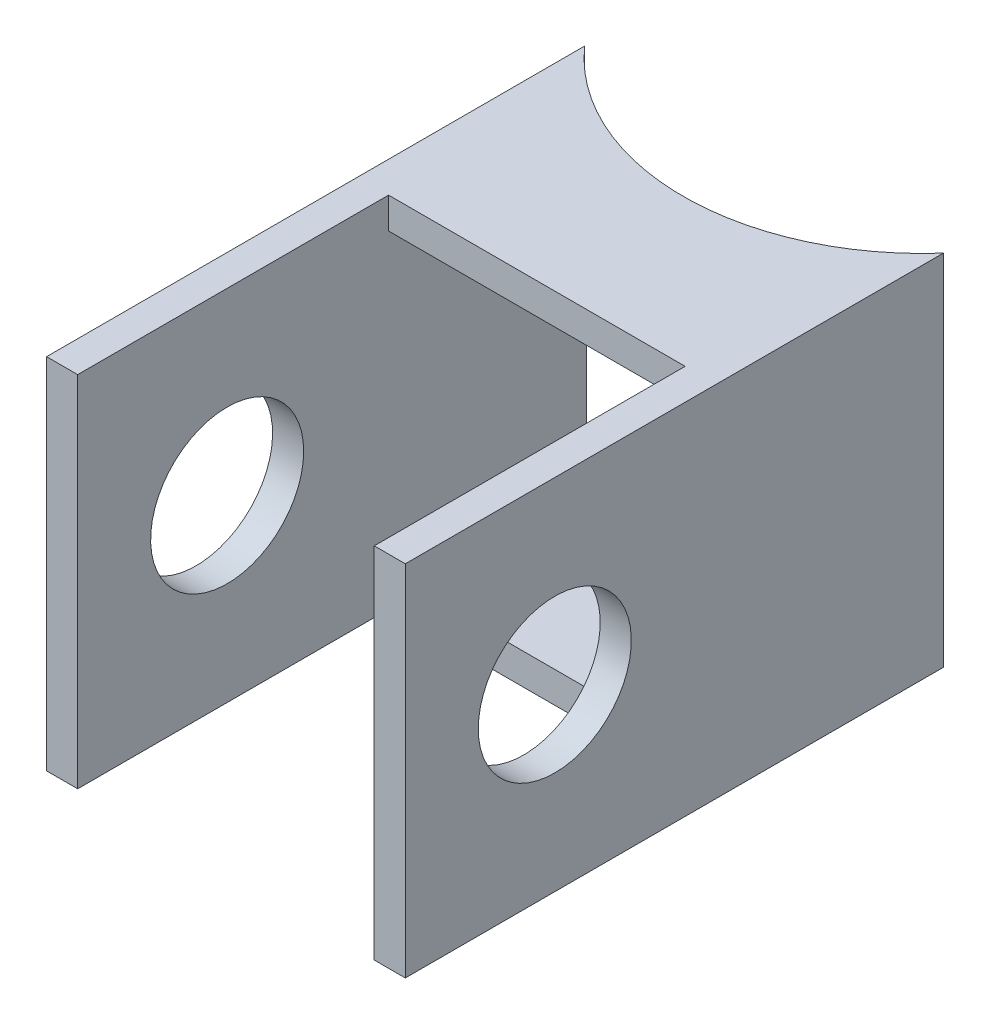
from build123d import *

# Parameters (mm, degrees)
SKETCH1_W               = 19.05
SKETCH1_H               = 19.05
SKETCH1_W_2             = 15.748
SKETCH1_H_2             = 15.748
BOSS_EXTRUDE1_DEPTH     = 28.575
CUT_EXTRUDE5_DEPTH      = 36.639286609
CUT_EXTRUDE5_DEPTH_BACK = 36.639286609
SKETCH5_R               = 12.7
CUT_EXTRUDE2_DEPTH      = 36.639286609
CUT_EXTRUDE2_DEPTH_BACK = 36.639286609
SKETCH3_R               = 4.064
CUT_EXTRUDE4_DEPTH      = 36.639286609
CUT_EXTRUDE4_DEPTH_BACK = 36.639286609
SKETCH4_W               = 15.748
SKETCH4_H               = 16.51


with BuildPart() as part:
    # Sketch1 → Boss-Extrude1 (new body)
    with BuildSketch(Plane.XY):
        Rectangle(SKETCH1_W, SKETCH1_H)
        Rectangle(SKETCH1_W_2, SKETCH1_H_2, mode=Mode.SUBTRACT)
    extrude(amount=BOSS_EXTRUDE1_DEPTH)

    # Sketch5 → Cut-Extrude5 (cut, two sides: drawn at the far end of the back side and taken through both)
    with BuildSketch(Plane(origin=(0, 9.525, 0), x_dir=(1, 0, 0), z_dir=(0, 1, 0)).offset(-CUT_EXTRUDE5_DEPTH_BACK)):
        with Locations((0, 8.400260413)):
            Circle(SKETCH5_R)
    extrude(amount=CUT_EXTRUDE5_DEPTH + CUT_EXTRUDE5_DEPTH_BACK, mode=Mode.SUBTRACT)

    # Sketch3 → Cut-Extrude2 (cut, two sides: drawn at the far end of the back side and taken through both)
    with BuildSketch(Plane(origin=(9.525, 0, 0), x_dir=(0, 0, -1), z_dir=(1, 0, 0)).offset(-CUT_EXTRUDE2_DEPTH_BACK)):
        with Locations((-20.6375, 0)):
            Circle(SKETCH3_R)
    extrude(amount=CUT_EXTRUDE2_DEPTH + CUT_EXTRUDE2_DEPTH_BACK, mode=Mode.SUBTRACT)

    # Sketch4 → Cut-Extrude4 (cut, two sides: drawn at the far end of the back side and taken through both)
    with BuildSketch(Plane.XZ.offset(9.525).offset(-CUT_EXTRUDE4_DEPTH_BACK)):
        with Locations((0, 20.32)):
            Rectangle(SKETCH4_W, SKETCH4_H)
    extrude(amount=CUT_EXTRUDE4_DEPTH + CUT_EXTRUDE4_DEPTH_BACK, mode=Mode.SUBTRACT)


solid = part.part
